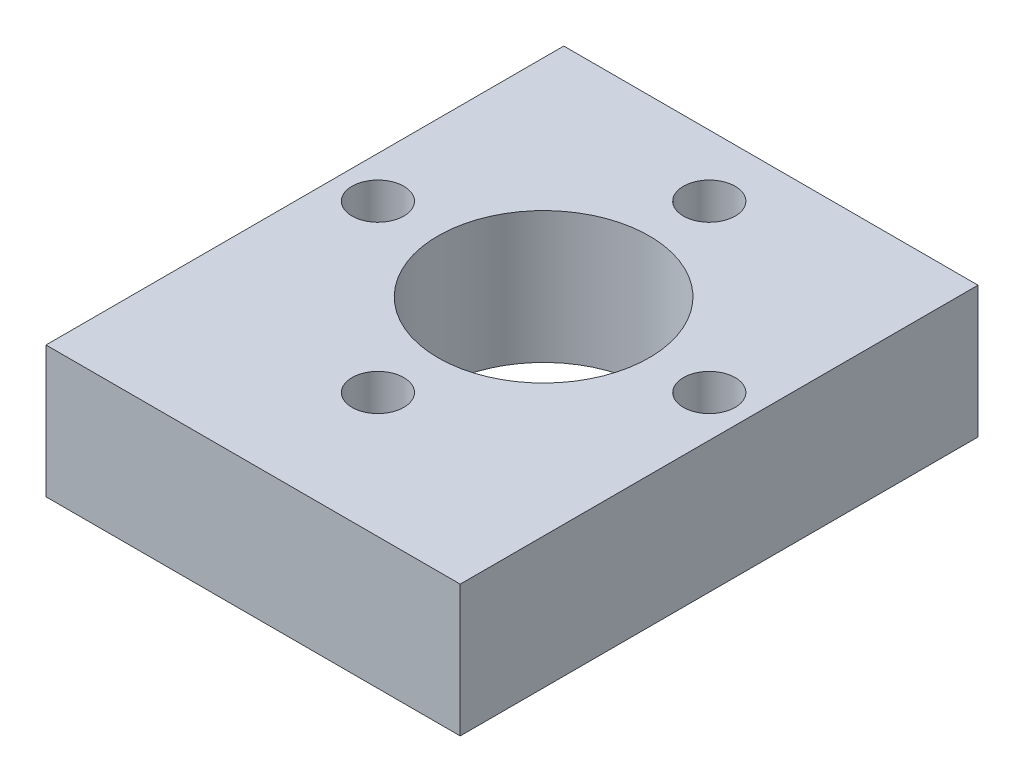
from build123d import *

# Parameters (mm, degrees)
SKETCH1_W                       = 20
SKETCH1_H                       = 25
SKETCH1_R                       = 5.1
BOSS_EXTRUDE1_DEPTH             = 6.35
TAP_DRILL_FOR_M3X0_5_TAP1_D     = 2.5
TAP_DRILL_FOR_M3X0_5_TAP3_D     = 2.5
TAP_DRILL_FOR_M3X0_5_TAP3_DEPTH = 6
TAP_DRILL_FOR_M3X0_5_TAP3_TIP   = 0.751075774


with BuildPart() as part:
    # Sketch1 → Boss-Extrude1 (new body)
    with BuildSketch(Plane(origin=(0, 0, 0), x_dir=(1, 0, 0), z_dir=(0, 1, 0))):
        Rectangle(SKETCH1_W, SKETCH1_H)
        with Locations(Location((0, 1.5261946, 0), (0, 0, 270))):
            Circle(SKETCH1_R, mode=Mode.SUBTRACT)
    extrude(amount=BOSS_EXTRUDE1_DEPTH)

    # Tap Drill for M3x0.5 Tap1 (through all)
    with Locations(Plane(origin=(0, 6.35, 0), x_dir=(1, 0, 0), z_dir=(0, 1, 0))):
        with Locations((-8, 1.5261946), (0, 9.5261946), (8, 1.5261946), (0, -6.4738054)):
            Hole(TAP_DRILL_FOR_M3X0_5_TAP1_D / 2)

    # Tap Drill for M3x0.5 Tap3
    with Locations(Plane(origin=(0, 0, -12.5), x_dir=(-1, 0, 0), z_dir=(0, 0, -1))):
        with Locations((-7, 3.175), (7, 3.175)):
            Hole(TAP_DRILL_FOR_M3X0_5_TAP3_D / 2, depth=TAP_DRILL_FOR_M3X0_5_TAP3_DEPTH)
            with Locations((0, 0, -(TAP_DRILL_FOR_M3X0_5_TAP3_DEPTH + TAP_DRILL_FOR_M3X0_5_TAP3_TIP / 2))):  # 118° drill point
                Cone(0, TAP_DRILL_FOR_M3X0_5_TAP3_D / 2, TAP_DRILL_FOR_M3X0_5_TAP3_TIP, mode=Mode.SUBTRACT)


solid = part.part
